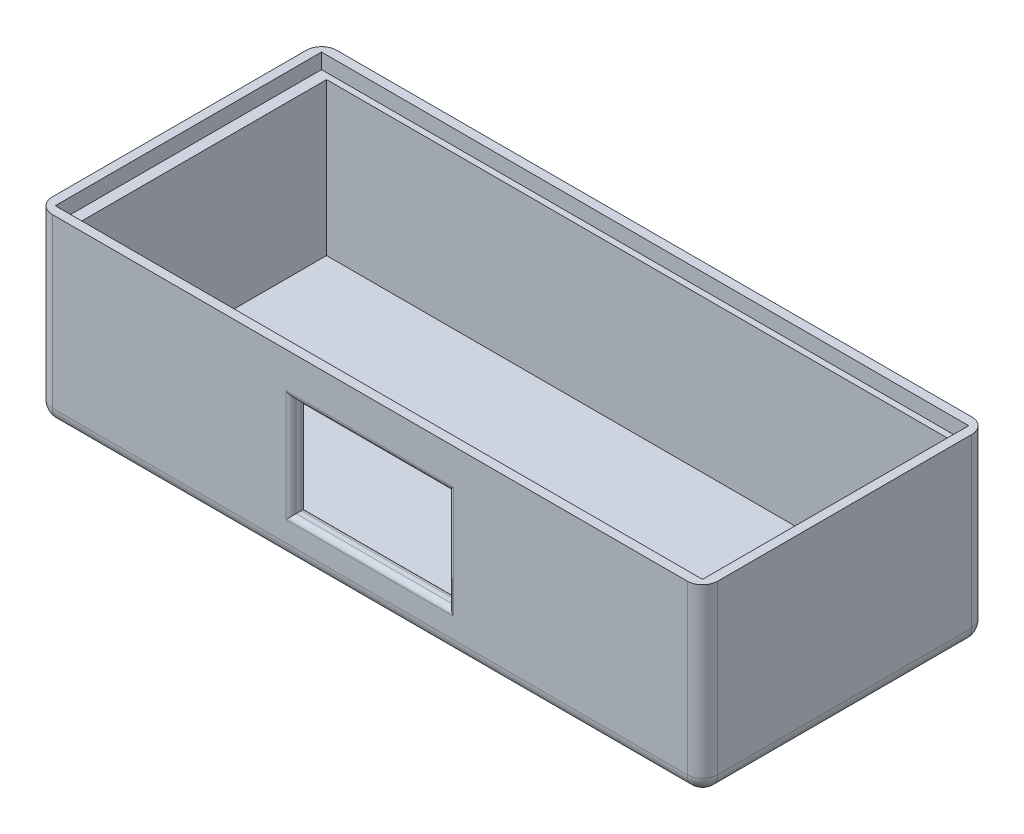
from build123d import *

# Parameters (mm, degrees)
SKETCH_1_W          = 131
SKETCH_1_H          = 36
SKETCH_1_W_2        = 125
SKETCH_1_H_2        = 30
EXTRUDE_3_DEPTH     = 50
SKETCH_4_W          = 131
SKETCH_4_H          = 36
EXTRUDE_4_DEPTH     = 3
SKETCH_5_R          = 7.5
CUT_EXTRUDE_1_DEPTH = 3
CUT_EXTRUDE_2_DEPTH = 3
SKETCH_11_W         = 1
SKETCH_11_H         = 30
EXTRUDE_6_DEPTH     = 50
SKETCH_8_W          = 131
SKETCH_8_H          = 36
EXTRUDE_7_DEPTH     = 3
SKETCH_12_W         = 127.4
SKETCH_12_H         = 52.4
CUT_EXTRUDE_4_DEPTH = 3
CUT_EXTRUDE_5_DEPTH = 3
FILLET_5_R          = 3
FILLET_6_R          = 1


with BuildPart() as part:
    # 草图1 → 凸台-拉伸3 (new body)
    with BuildSketch(Plane.XY):
        with Locations((62.5, -15)):
            Rectangle(SKETCH_1_W, SKETCH_1_H)
        with Locations((62.5, -15)):
            Rectangle(SKETCH_1_W_2, SKETCH_1_H_2, mode=Mode.SUBTRACT)
    extrude(amount=EXTRUDE_3_DEPTH)

    # 草图4 → 凸台-拉伸4 (add)
    with BuildSketch(Plane(origin=(0, 0, 0), x_dir=(-1, 0, 0), z_dir=(0, 0, -1))):
        with Locations((-62.5, -15)):
            Rectangle(SKETCH_4_W, SKETCH_4_H)
    extrude(amount=EXTRUDE_4_DEPTH)

    # 草图5 → 切除-拉伸1 (cut)
    with BuildSketch(Plane(origin=(0, 3, 0), x_dir=(1, 0, 0), z_dir=(0, 1, 0))):
        with Locations(Location((17.5, -30, 0), (0, 0, 270))):
            Circle(SKETCH_5_R)
        with Locations(Location((47.5, -30, 0), (0, 0, 270))):
            Circle(SKETCH_5_R)
        with Locations(Location((77.5, -30, 0), (0, 0, 270))):
            Circle(SKETCH_5_R)
        with Locations(Location((107.5, -30, 0), (0, 0, 270))):
            Circle(SKETCH_5_R)
    extrude(amount=-CUT_EXTRUDE_1_DEPTH, mode=Mode.SUBTRACT)

    # 草图6 → 切除-拉伸2 (cut)
    with BuildSketch(Plane.XZ.offset(33)):
        Polygon((10, 25), (10, 27.5), (115, 27.5), (115, 25), (115, 22.5), (10, 22.5), align=None)
    extrude(amount=-CUT_EXTRUDE_2_DEPTH, mode=Mode.SUBTRACT)

    # 草图11 → 凸台-拉伸6 (add)
    with BuildSketch(Plane.XY.offset(50)):
        with Locations((0.5, -15)):
            Rectangle(SKETCH_11_W, SKETCH_11_H)
        with Locations((124.5, -15)):
            Rectangle(SKETCH_11_W, SKETCH_11_H)
    extrude(amount=-EXTRUDE_6_DEPTH)

    # 草图8 → 凸台-拉伸7 (add)
    with BuildSketch(Plane.XY.offset(50)):
        with Locations((62.5, -15)):
            Rectangle(SKETCH_8_W, SKETCH_8_H)
    extrude(amount=EXTRUDE_7_DEPTH)

    # 草图12 → 切除-拉伸4 (cut)
    with BuildSketch(Plane(origin=(0, 3, 0), x_dir=(1, 0, 0), z_dir=(0, 1, 0))):
        with Locations((62.5, -25)):
            Rectangle(SKETCH_12_W, SKETCH_12_H)
    extrude(amount=-CUT_EXTRUDE_4_DEPTH, mode=Mode.SUBTRACT)

    # 草图13 → 切除-拉伸5 (cut)
    with BuildSketch(Plane.XY.offset(53)):
        Polygon((47, -15), (47, -5), (78, -5), (78, -25), (47, -25), align=None)
    extrude(amount=-CUT_EXTRUDE_5_DEPTH, mode=Mode.SUBTRACT)

    # 圆角5
    fillet_5_edges = [part.edges().sort_by_distance(p)[0] for p in [
        (-3, -15, 53),
        (62.5, -33, 53),
        (128, -15, 53),
        (128, -15, -3),
        (62.5, -33, -3),
        (-3, -15, -3),
        (128, -33, 25),
        (-3, -33, 25),
    ]]
    fillet(fillet_5_edges, radius=FILLET_5_R)

    # 圆角6
    fillet_6_edges = [part.edges().sort_by_distance(p)[0] for p in [
        (47, -15, 50),
        (62.5, -5, 50),
        (78, -15, 50),
        (62.5, -25, 50),
        (47, -15, 53),
        (62.5, -25, 53),
        (78, -15, 53),
        (62.5, -5, 53),
    ]]
    fillet(fillet_6_edges, radius=FILLET_6_R)


solid = part.part
